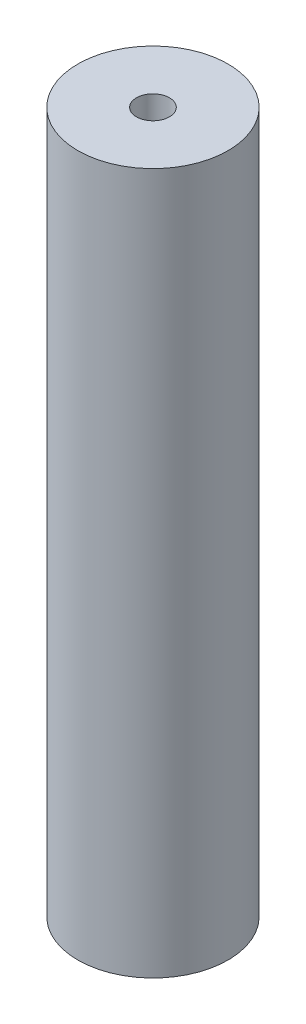
from build123d import *

# Parameters (mm, degrees)
SKETCH_1_R      = 7.5
EXTRUDE_1_DEPTH = 70


with BuildPart() as part:
    # ｽｹｯﾁ1 → ﾎﾞｽ - 押し出し1 (new body)
    with BuildSketch(Plane(origin=(0, 0, 0), x_dir=(1, 0, 0), z_dir=(0, 1, 0))):
        with Locations(Location((0, 0, 0), (0, 0, 270))):
            Circle(SKETCH_1_R)
    extrude(amount=EXTRUDE_1_DEPTH)

    # ｽｹｯﾁ3 → M4x0.7 ねじ穴1 (revolve, cut)
    with BuildSketch(Plane(origin=(0, 70, 0), x_dir=(0, 0, 1), z_dir=(1, 0, 0))):
        Polygon((0, 0), (0, 20.991420021), (1.65, 20), (1.65, 0), align=None)
    m4x0_7_1 = revolve(axis=Axis((0, 76.35, 0), (0, -1, 0)), mode=Mode.SUBTRACT)

    # ﾐﾗｰ1: M4x0.7 ねじ穴1 across plane
    add(m4x0_7_1.mirror(Plane.ZX.offset(35)), mode=Mode.SUBTRACT)


solid = part.part
